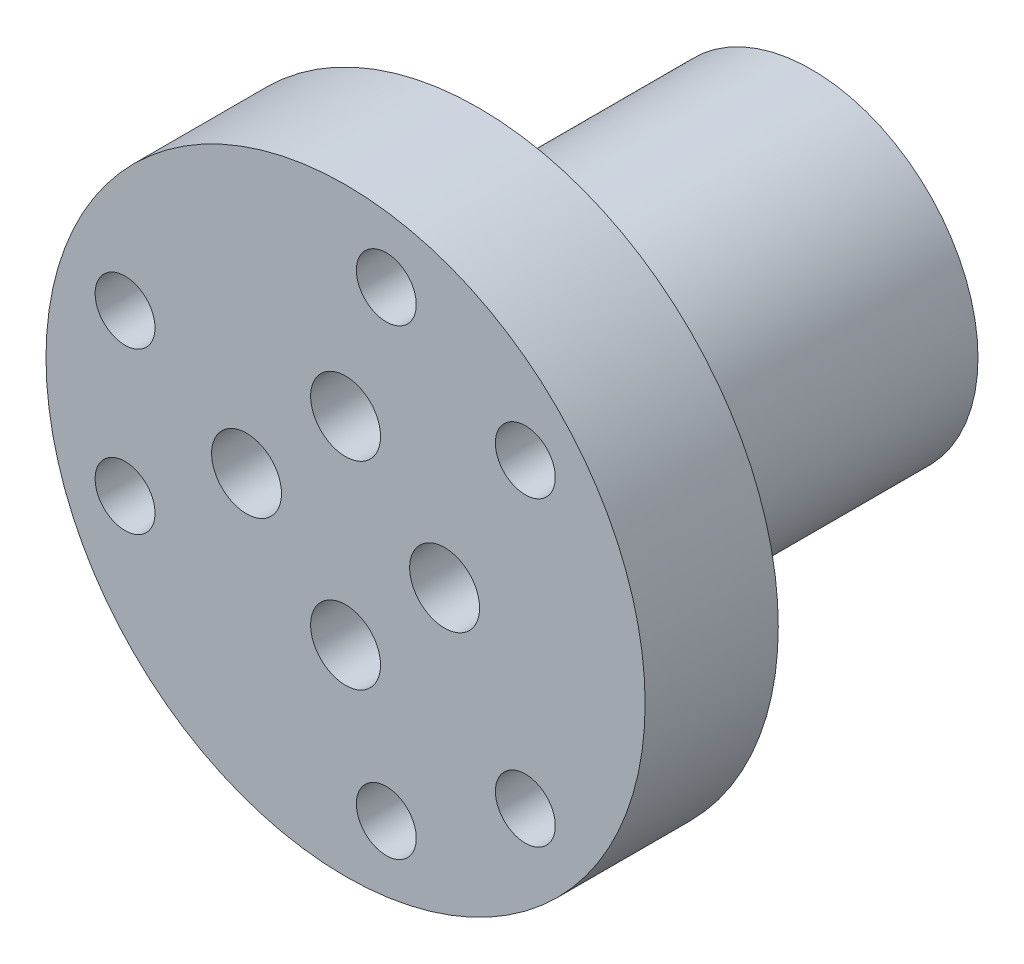
from build123d import *
from build123d.topology import SkipClean

# Parameters (mm, degrees)
SKETCH_1_R                   = 18
SKETCH_1_R_2                 = 1.3
SKETCH_1_R_3                 = 1.6
EXTRUDE_1_DEPTH              = 8
SKETCH_5_R                   = 2.1
CUT_EXTRUDE_1_DEPTH          = 6.6
HOLE_WIZARD_M3_2_D           = 3.6
HOLE_WIZARD_M3_2_CSINK_D     = 6.3
HOLE_WIZARD_M3_2_CSINK_ANGLE = 90
EXTRUDE_START                = 2
SKETCH_8_R                   = 10
SKETCH_8_R_2                 = 1.3
EXTRUDE_2_DEPTH              = 2
SKETCH_9_R                   = 10
SKETCH_9_R_2                 = 2.1
EXTRUDE_3_DEPTH              = 18
EXTRUDE_START_2              = -3.4
SKETCH_10_R                  = 2.1
SKETCH_10_R_2                = 1.25
EXTRUDE_4_DEPTH              = 3.4
SKETCH_11_R                  = 2.1
CUT_EXTRUDE_2_DEPTH          = 3.4


with BuildPart() as part:
    # 스케치1 → 보스-돌출1 (new body)
    with BuildSketch(Plane.XY):
        Circle(SKETCH_1_R)
        with Locations((0, 5.95)):
            Circle(SKETCH_1_R_2, mode=Mode.SUBTRACT)
        with Locations((5.95, 0)):
            Circle(SKETCH_1_R_2, mode=Mode.SUBTRACT)
        with Locations((0, -5.95)):
            Circle(SKETCH_1_R_2, mode=Mode.SUBTRACT)
        with Locations((-5.95, 0)):
            Circle(SKETCH_1_R_2, mode=Mode.SUBTRACT)
        with Locations((-13.249665953, 4.822484021)):
            Circle(SKETCH_1_R_3, mode=Mode.SUBTRACT)
        with Locations(Location((-13.249665953, -4.822484021, 0), (0, 0, 180))):
            Circle(SKETCH_1_R_3, mode=Mode.SUBTRACT)
        with Locations((10.801226648, 9.063305297)):
            Circle(SKETCH_1_R_3, mode=Mode.SUBTRACT)
        with Locations(Location((2.448439305, 13.885789317, 0), (0, 0, 180))):
            Circle(SKETCH_1_R_3, mode=Mode.SUBTRACT)
        with Locations((2.448439305, -13.885789317)):
            Circle(SKETCH_1_R_3, mode=Mode.SUBTRACT)
        with Locations(Location((10.801226648, -9.063305297, 0), (0, 0, 180))):
            Circle(SKETCH_1_R_3, mode=Mode.SUBTRACT)
    extrude(amount=EXTRUDE_1_DEPTH)

    # 스케치5 → 컷-돌출1 (cut)
    with BuildSketch(Plane.XY.offset(8)):
        with Locations((0, 5.95)):
            Circle(SKETCH_5_R)
        with Locations((0, -5.95)):
            Circle(SKETCH_5_R)
        with Locations((5.95, 0)):
            Circle(SKETCH_5_R)
        with Locations((-5.95, 0)):
            Circle(SKETCH_5_R)
    extrude(amount=-CUT_EXTRUDE_1_DEPTH, mode=Mode.SUBTRACT)

    # M3 접시 머리 나사용 카운터싱크2 (through all)
    with Locations(Plane(origin=(0, 0, 0), x_dir=(-1, 0, 0), z_dir=(0, 0, -1))):
        with Locations((-2.448439305, 13.885789317), (13.249665953, 4.822484021), (13.249665953, -4.822484021), (-2.448439305, -13.885789317), (-10.801226648, -9.063305297), (-10.801226648, 9.063305297)):
            CounterSinkHole(HOLE_WIZARD_M3_2_D / 2, HOLE_WIZARD_M3_2_CSINK_D / 2, counter_sink_angle=HOLE_WIZARD_M3_2_CSINK_ANGLE)

    # 스케치8 → 보스-돌출2 (add)
    with BuildSketch(Plane(origin=(0, 0, 0), x_dir=(-1, 0, 0), z_dir=(0, 0, -1)).offset(EXTRUDE_START)):
        with Locations(Location((0, 0, 0), (0, 0, 180))):
            Circle(SKETCH_8_R)
        with Locations((0, 5.95)):
            Circle(SKETCH_8_R_2, mode=Mode.SUBTRACT)
        with Locations((5.95, 0)):
            Circle(SKETCH_8_R_2, mode=Mode.SUBTRACT)
        with Locations((0, -5.95)):
            Circle(SKETCH_8_R_2, mode=Mode.SUBTRACT)
        with Locations((-5.95, 0)):
            Circle(SKETCH_8_R_2, mode=Mode.SUBTRACT)
    extrude(amount=-EXTRUDE_2_DEPTH)

    # 스케치9 → 보스-돌출3 (add)
    with SkipClean():  # the faces are left unmerged after this step: merging them gives an invalid solid
        with BuildSketch(Plane(origin=(0, 0, -2), x_dir=(-1, 0, 0), z_dir=(0, 0, -1))):
            with Locations(Location((0, 0, 0), (0, 0, 180))):
                Circle(SKETCH_9_R)
            with Locations(Location((5.95, 0, 0), (0, 0, 180))):
                Circle(SKETCH_9_R_2, mode=Mode.SUBTRACT)
            with Locations(Location((0, 5.95, 0), (0, 0, 180))):
                Circle(SKETCH_9_R_2, mode=Mode.SUBTRACT)
            with Locations(Location((-5.95, 0, 0), (0, 0, 180))):
                Circle(SKETCH_9_R_2, mode=Mode.SUBTRACT)
            with Locations(Location((0, -5.95, 0), (0, 0, 180))):
                Circle(SKETCH_9_R_2, mode=Mode.SUBTRACT)
        extrude(amount=EXTRUDE_3_DEPTH)

    # 스케치10 → 보스-돌출4 (add)
    # profile 1 of 4: a face of its own
    with SkipClean():  # the faces are left unmerged after this step: merging them gives an invalid solid
        with BuildSketch(Plane(origin=(0, 0, -20), x_dir=(-1, 0, 0), z_dir=(0, 0, -1)).offset(EXTRUDE_START_2)):
            with Locations((5.95, 0)):
                Circle(SKETCH_10_R)
            with Locations((5.95, 0)):
                Circle(SKETCH_10_R_2, mode=Mode.SUBTRACT)
        # profile 2 of 4: a face of its own
        with BuildSketch(Plane(origin=(0, 0, -20), x_dir=(-1, 0, 0), z_dir=(0, 0, -1)).offset(EXTRUDE_START_2)):
            with Locations((0, -5.95)):
                Circle(SKETCH_10_R)
            with Locations((0, -5.95)):
                Circle(SKETCH_10_R_2, mode=Mode.SUBTRACT)
        # profile 3 of 4: a face of its own
        with BuildSketch(Plane(origin=(0, 0, -20), x_dir=(-1, 0, 0), z_dir=(0, 0, -1)).offset(EXTRUDE_START_2)):
            with Locations((-5.95, 0)):
                Circle(SKETCH_10_R)
            with Locations((-5.95, 0)):
                Circle(SKETCH_10_R_2, mode=Mode.SUBTRACT)
        # profile 4 of 4: a face of its own
        with BuildSketch(Plane(origin=(0, 0, -20), x_dir=(-1, 0, 0), z_dir=(0, 0, -1)).offset(EXTRUDE_START_2)):
            with Locations((0, 5.95)):
                Circle(SKETCH_10_R)
            with Locations((0, 5.95)):
                Circle(SKETCH_10_R_2, mode=Mode.SUBTRACT)
        extrude(amount=EXTRUDE_4_DEPTH)

    # 스케치11 → 컷-돌출2 (cut)
    with BuildSketch(Plane.XY.offset(1.4)):
        with Locations((5.95, 0)):
            Circle(SKETCH_11_R)
        with Locations((0, -5.95)):
            Circle(SKETCH_11_R)
        with Locations((0, 5.95)):
            Circle(SKETCH_11_R)
        with Locations((-5.95, 0)):
            Circle(SKETCH_11_R)
    extrude(amount=-CUT_EXTRUDE_2_DEPTH, mode=Mode.SUBTRACT)


solid = part.part
